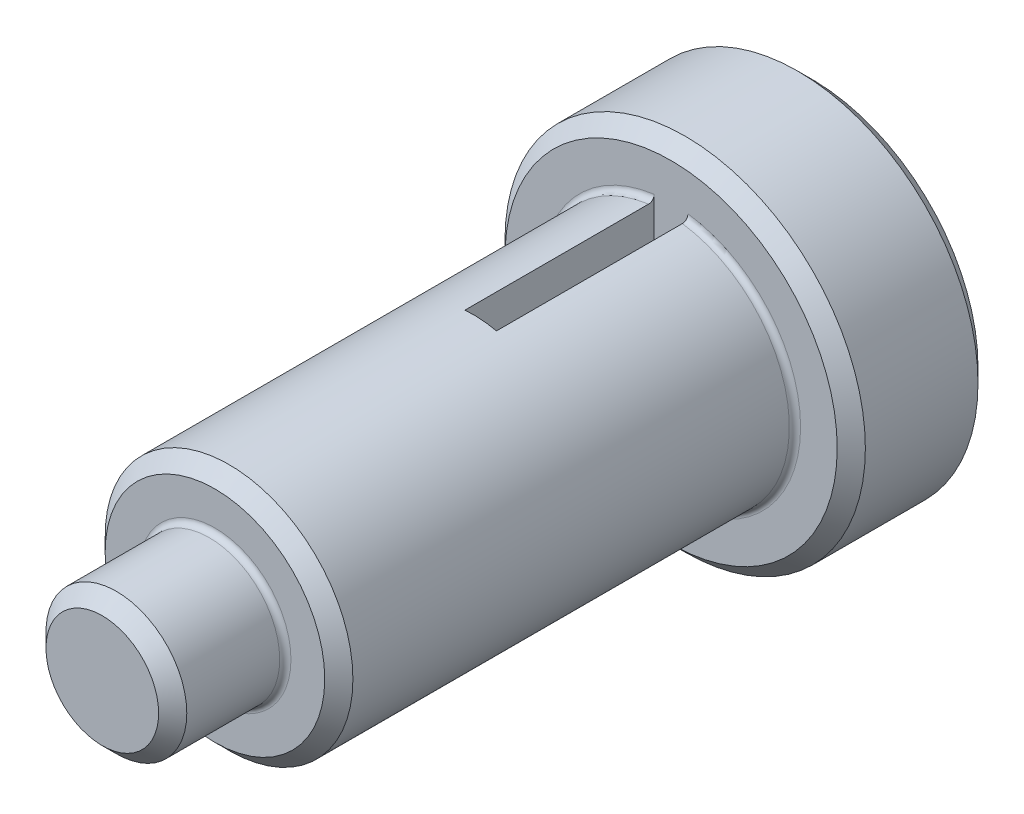
from build123d import *

# Parameters (mm, degrees)
SKETCH1_R           = 32
BOSS_EXTRUDE1_DEPTH = 25
SKETCH2_R           = 22
BOSS_EXTRUDE2_DEPTH = 81
SKETCH3_R           = 12.5
BOSS_EXTRUDE3_DEPTH = 20
SKETCH4_R           = 16
CUT_EXTRUDE1_DEPTH  = 77
CUT_EXTRUDE2_DEPTH  = 145.899965493
CHAMFER1_SIZE       = 2.5
FILLET1_R           = 1


with BuildPart() as part:
    # Sketch1 → Boss-Extrude1 (new body)
    with BuildSketch(Plane.XY):
        Circle(SKETCH1_R)
    extrude(amount=BOSS_EXTRUDE1_DEPTH)

    # Sketch2 → Boss-Extrude2 (add)
    with BuildSketch(Plane.XY.offset(25)):
        Circle(SKETCH2_R)
    extrude(amount=BOSS_EXTRUDE2_DEPTH)

    # Sketch3 → Boss-Extrude3 (add)
    with BuildSketch(Plane.XY.offset(106)):
        Circle(SKETCH3_R)
    extrude(amount=BOSS_EXTRUDE3_DEPTH)

    # Sketch4 → Cut-Extrude1 (cut)
    with BuildSketch(Plane(origin=(0, 0, 0), x_dir=(-1, 0, 0), z_dir=(0, 0, -1))):
        Circle(SKETCH4_R)
    extrude(amount=-CUT_EXTRUDE1_DEPTH, mode=Mode.SUBTRACT)

    # Sketch5 → Cut-Extrude2 (cut, through all)
    with BuildSketch(Plane(origin=(0, 32, 0), x_dir=(1, 0, 0), z_dir=(0, 1, 0))):
        Polygon((3, -25), (3, -59), (-3, -58.60148044), (-3, -25), align=None)
    extrude(amount=-CUT_EXTRUDE2_DEPTH, mode=Mode.SUBTRACT)

    # Chamfer1
    chamfer1_edges = [part.edges().sort_by_distance(p)[0] for p in [
        (-12.5, 0, 126),
        (-32, 0, 0),
        (-32, 0, 25),
        (-22, 0, 106),
    ]]
    chamfer(chamfer1_edges, length=CHAMFER1_SIZE)

    # Fillet1
    fillet1_edges = [part.edges().sort_by_distance(p)[0] for p in [
        (-12.5, 0, 106),
        (-22, 0, 25),
        (16.583123952, 14.456832295, 25),
    ]]
    fillet(fillet1_edges, radius=FILLET1_R)


solid = part.part
